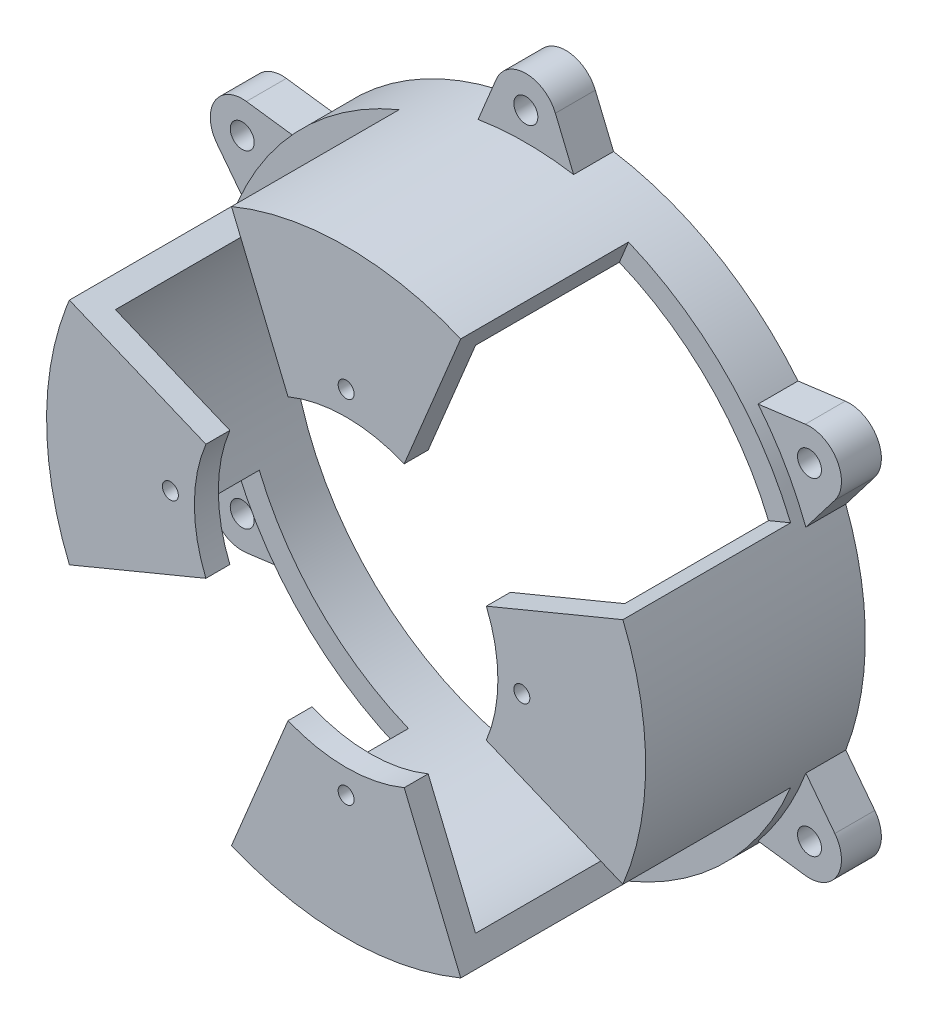
from build123d import *

# Parameters (mm, degrees)
SKETCH_1_R               = 37.5
SKETCH_1_R_2             = 34.5
EXTRUDE_1_DEPTH          = 24.5
SKETCH_2_R               = 1.5
EXTRUDE_2_DEPTH          = 5
PATTERN_CIRCULAR_1_COUNT = 6
SKETCH_3_R               = 37.5
SKETCH_3_R_2             = 19
EXTRUDE_3_DEPTH          = 3
SKETCH_4_R               = 1
CUT_EXTRUDE_1_DEPTH      = 3
CUT_EXTRUDE_START        = -21
CUT_EXTRUDE_2_DEPTH      = 21
PATTERN_CIRCULAR_2_COUNT = 4


with BuildPart() as part:
    # Эскиз1 → Бобышка-Вытянуть1 (new body)
    with BuildSketch(Plane.XY):
        Circle(SKETCH_1_R)
        Circle(SKETCH_1_R_2, mode=Mode.SUBTRACT)
    extrude(amount=EXTRUDE_1_DEPTH)

    # Эскиз2 → Бобышка-Вытянуть2 (add)
    with BuildSketch(Plane(origin=(0, 0, 0), x_dir=(-1, 0, 0), z_dir=(0, 0, -1))):
        with BuildLine():
            Line((-3.69551813, 42.530733729), (-5.977950182, 37.020455313))
            ThreePointArc((-5.977950182, 37.020455313), (0, 37.5), (5.977950182, 37.020455313))
            Line((5.977950182, 37.020455313), (3.69551813, 42.530733729))
            ThreePointArc((3.69551813, 42.530733729), (0, 45), (-3.69551813, 42.530733729))
        make_face()
        with Locations((0, 41)):
            Circle(SKETCH_2_R, mode=Mode.SUBTRACT)
    extrude_2 = extrude(amount=-EXTRUDE_2_DEPTH)

    # Круговой массив1: Бобышка-Вытянуть2 ×6 about axis
    pattern_circular_1_axis = Axis((0, 0, 0), (0, 0, 1))
    for i in range(1, PATTERN_CIRCULAR_1_COUNT):
        add(extrude_2.rotate(pattern_circular_1_axis, i * 360 / PATTERN_CIRCULAR_1_COUNT))

    # Эскиз3 → Бобышка-Вытянуть3 (add)
    with BuildSketch(Plane.XY.offset(24.5)):
        with Locations(Location((0, 0, 0), (0, 0, 159.172768539))):
            Circle(SKETCH_3_R)
        Circle(SKETCH_3_R_2, mode=Mode.SUBTRACT)
    extrude(amount=EXTRUDE_3_DEPTH)

    # Эскиз4 → Вырез-Вытянуть1 (cut)
    with BuildSketch(Plane.XY.offset(27.5)):
        with Locations((22, 0)):
            Circle(SKETCH_4_R)
        with Locations((0, -22)):
            Circle(SKETCH_4_R)
        with Locations((-22, 0)):
            Circle(SKETCH_4_R)
        with Locations((0, 22)):
            Circle(SKETCH_4_R)
    extrude(amount=-CUT_EXTRUDE_1_DEPTH, mode=Mode.SUBTRACT)

    # Эскиз5 → Вырез-Вытянуть2 (cut)
    with BuildSketch(Plane.XY.offset(27.5).offset(CUT_EXTRUDE_START)):
        with BuildLine():
            Line((0, 0), (34.645482469, 14.350628714))
            ThreePointArc((34.645482469, 14.350628714), (26.516504294, 26.516504294), (14.350628714, 34.645482469))
            Line((14.350628714, 34.645482469), (0, 0))
        make_face()
    cut_extrude_2 = extrude(amount=CUT_EXTRUDE_2_DEPTH, mode=Mode.SUBTRACT)

    # Круговой массив2: Вырез-Вытянуть2 ×4 about axis
    pattern_circular_2_axis = Axis((0, 0, 24.5), (0, 0, -1))
    for i in range(1, PATTERN_CIRCULAR_2_COUNT):
        add(cut_extrude_2.rotate(pattern_circular_2_axis, i * 360 / PATTERN_CIRCULAR_2_COUNT), mode=Mode.SUBTRACT)


solid = part.part
